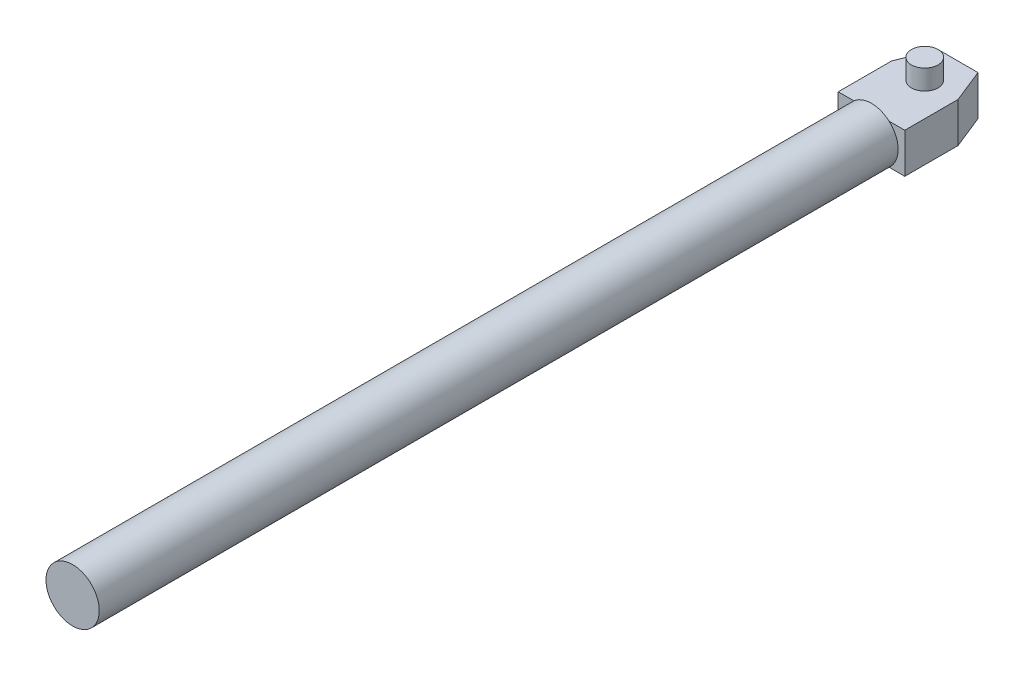
from build123d import *

# Parameters (mm, degrees)
SKETCH1_R           = 20
BOSS_EXTRUDE1_DEPTH = 600
BOSS_EXTRUDE2_DEPTH = 15
SKETCH3_R           = 10
BOSS_EXTRUDE3_DEPTH = 30


with BuildPart() as part:
    # Sketch1 → Boss-Extrude1 (new body)
    with BuildSketch(Plane.XY):
        Circle(SKETCH1_R)
    extrude(amount=BOSS_EXTRUDE1_DEPTH)

    # Sketch2 → Boss-Extrude2 (add, symmetric)
    with BuildSketch(Plane(origin=(0, 0, 0), x_dir=(1, 0, 0), z_dir=(0, 1, 0))):
        Polygon((-25, 40), (-15, 65), (15, 65), (25, 40), (25, 0), (-25, 0), align=None)
    extrude(amount=BOSS_EXTRUDE2_DEPTH, both=True)

    # Sketch3 → Boss-Extrude3 (add, symmetric)
    with BuildSketch(Plane(origin=(0, 0, 0), x_dir=(1, 0, 0), z_dir=(0, 1, 0))):
        with Locations(Location((0, 40, 0), (0, 0, 90))):
            Circle(SKETCH3_R)
    extrude(amount=BOSS_EXTRUDE3_DEPTH, both=True)


solid = part.part
